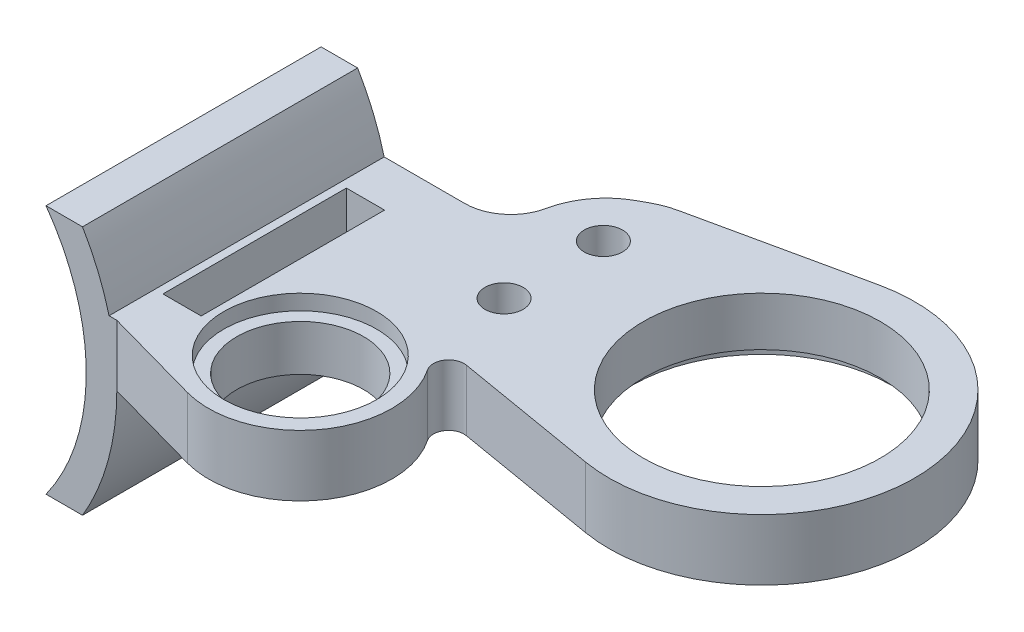
from build123d import *

# Parameters (mm, degrees)
EXTRUDE_1_DEPTH     = 18
SKETCH_3_R          = 4.15
SKETCH_3_R_2        = 7.75
SKETCH_3_R_3        = 1.25
SKETCH_3_W          = 2.5
SKETCH_3_H          = 12
EXTRUDE_2_DEPTH     = 4
FILLET_1_R          = 5
FILLET_2_R          = 3
FILLET_3_R          = 1
SKETCH_7_R          = 8.5
CUT_EXTRUDE_2_DEPTH = 0.8
SKETCH_8_R          = 5
CUT_EXTRUDE_3_DEPTH = 1


with BuildPart() as part:
    # 草图1 → 凸台-拉伸1 (new body)
    with BuildSketch(Plane.XY):
        with BuildLine():
            Line((13.754950724, 8.173208097), (11.36655926, 8.173208097))
            ThreePointArc((11.36655926, 8.173208097), (14, 0), (11.36655926, -8.173208097))
            Line((11.36655926, -8.173208097), (13.754950724, -8.173208097))
            ThreePointArc((13.754950724, -8.173208097), (16, 0), (13.754950724, 8.173208097))
        make_face()
    extrude(amount=EXTRUDE_1_DEPTH)

    # 草图3 → 凸台-拉伸2 (add)
    with BuildSketch(Plane(origin=(0, 0, 0), x_dir=(1, 0, 0), z_dir=(0, 1, 0))):
        with BuildLine():
            Line((16, -18), (14.877475362, -18))
            Line((14.877475362, -18), (14.877475362, 0))
            Line((14.877475362, 0), (16, 0))
            Line((16, 0), (23.606969391, 0))
            Line((23.606969391, 0), (23.606969391, 4.353528312))
            Line((23.606969391, 4.353528312), (27.426147231, 6.432993818))
            Line((27.426147231, 6.432993818), (38.92049676, 8.930407807))
            ThreePointArc((38.92049676, 8.930407807), (51.041058959, -0.612171869), (39.370999256, -10.700708007))
            Line((39.370999256, -10.700708007), (26.396794679, -8.499511361))
            ThreePointArc((26.396794679, -8.499511361), (29.653921129, -16.00827684), (22.389974874, -19.779949748))
            Line((22.389974874, -19.779949748), (16, -18))
        make_face()
        with Locations(Location((24, -14, 0), (0, 0, 270))):
            Circle(SKETCH_3_R, mode=Mode.SUBTRACT)
        with Locations(Location((41.043691062, -0.841595363, 0), (0, 0, 270))):
            Circle(SKETCH_3_R_2, mode=Mode.SUBTRACT)
        with Locations(Location((27.426147231, -4.091595363, 0), (0, 0, 270))):
            Circle(SKETCH_3_R_3, mode=Mode.SUBTRACT)
        with Locations(Location((27.426147231, 2.408404637, 0), (0, 0, 270))):
            Circle(SKETCH_3_R_3, mode=Mode.SUBTRACT)
        with Locations((17.267287819, -9)):
            Rectangle(SKETCH_3_W, SKETCH_3_H, mode=Mode.SUBTRACT)
    extrude(amount=EXTRUDE_2_DEPTH)

    # 圆角1
    fillet_1_edges = [part.edges().sort_by_distance(p)[0] for p in [
        (27.426147231, 2, -6.432993818),
        (23.606969391, 2, -4.353528312),
    ]]
    fillet(fillet_1_edges, radius=FILLET_1_R)

    # 圆角2
    fillet_2_edges = [part.edges().sort_by_distance(p)[0] for p in [
        (23.606969391, 2, 0),
    ]]
    fillet(fillet_2_edges, radius=FILLET_2_R)

    # 圆角3
    fillet_3_edges = [part.edges().sort_by_distance(p)[0] for p in [
        (26.396794679, 2, 8.499511361),
    ]]
    fillet(fillet_3_edges, radius=FILLET_3_R)

    # 草图7 → 切除-拉伸2 (cut)
    with BuildSketch(Plane.XZ):
        with Locations(Location((41.043691062, 0.841595363, 0), (0, 0, 270))):
            Circle(SKETCH_7_R)
    extrude(amount=-CUT_EXTRUDE_2_DEPTH, mode=Mode.SUBTRACT)

    # 草图8 → 切除-拉伸3 (cut)
    with BuildSketch(Plane(origin=(0, 4, 0), x_dir=(1, 0, 0), z_dir=(0, 1, 0))):
        with Locations(Location((24, -14, 0), (0, 0, 270))):
            Circle(SKETCH_8_R)
    extrude(amount=-CUT_EXTRUDE_3_DEPTH, mode=Mode.SUBTRACT)


solid = part.part
